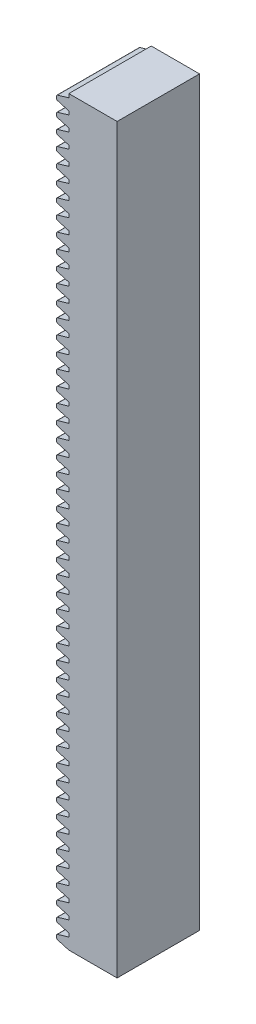
from build123d import *

# Parameters (mm, degrees)
BOSS_EXTRUDE1_DEPTH = 20
LPATTERN1_COUNT     = 50
LPATTERN1_PITCH     = 3.6


with BuildPart() as part:
    # Sketch1 → Boss-Extrude1 (new body)
    with BuildSketch(Plane.XY):
        with BuildLine():
            Line((15.069403078, -11.393413833), (12.321873519, -12.190605045))
            ThreePointArc((12.321873519, -12.190605045), (12.13955013, -12.316545974), (12.069403078, -12.5267419))
            Line((12.069403078, -12.5267419), (12.069403078, -13.000975962))
            ThreePointArc((12.069403078, -13.000975962), (12.13955013, -13.211171888), (12.321873519, -13.337112817))
            Line((12.321873519, -13.337112817), (15.021623573, -14.120440884))
            ThreePointArc((15.021623573, -14.120440884), (15.069898179, -14.130820911), (15.119153133, -14.134304029))
            Line((15.119153133, -14.134304029), (26.787248373, -14.134304029))
            Line((26.787248373, -14.134304029), (26.787248373, -10.493413833))
            Line((26.787248373, -10.493413833), (15.069403078, -10.493413833))
            Line((15.069403078, -10.493413833), (15.069403078, -11.393413833))
        make_face()
    boss_extrude1 = extrude(amount=BOSS_EXTRUDE1_DEPTH)

    # LPattern1: Boss-Extrude1 ×50
    with Locations(*[(0, i * LPATTERN1_PITCH, 0) for i in range(1, LPATTERN1_COUNT)]):
        add(boss_extrude1)


solid = part.part
